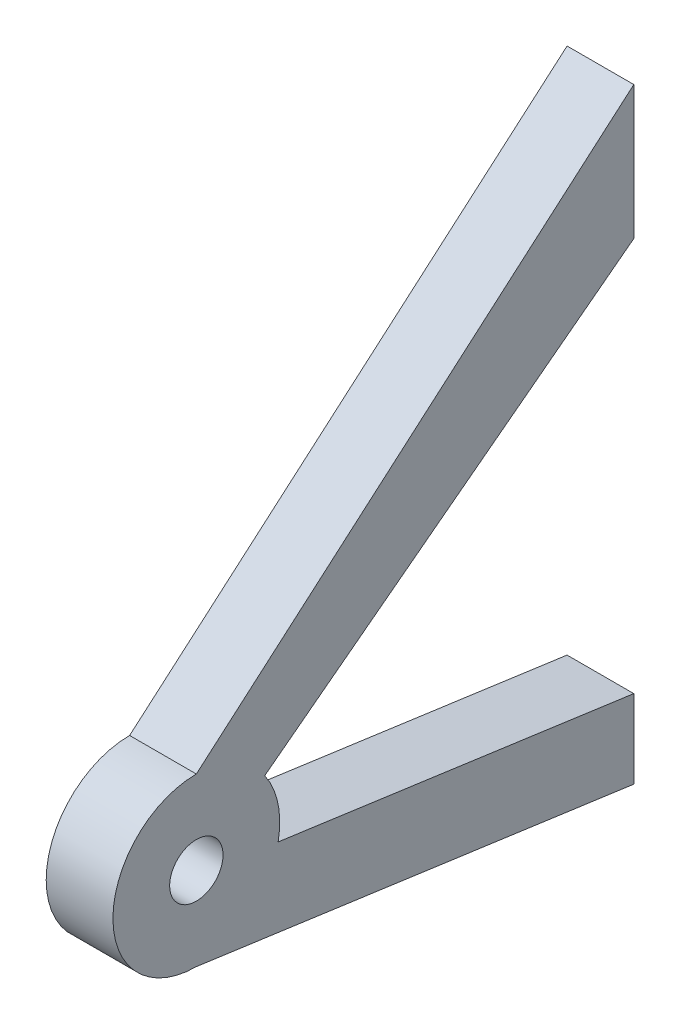
from build123d import *

# Parameters (mm, degrees)
SKETCH1_R           = 2.54
BOSS_EXTRUDE1_DEPTH = 6.35


with BuildPart() as part:
    # Sketch1 → Boss-Extrude1 (new body)
    with BuildSketch(Plane(origin=(-21.577168497, 0, 0), x_dir=(0, 0, -1), z_dir=(1, 0, 0))):
        with BuildLine():
            Line((-122.387241806, 61.361669294), (-164.013892996, 25.356612642))
            ThreePointArc((-164.013892996, 25.356612642), (-171.951392996, 17.419112642), (-164.013892996, 9.481612642))
            Line((-164.013892996, 9.481612642), (-122.387241806, 3.703044496))
            Line((-122.387241806, 3.703044496), (-122.387241806, 11.169831477))
            Line((-122.387241806, 11.169831477), (-156.229469136, 15.867774051))
            ThreePointArc((-156.229469136, 15.867774051), (-156.245156978, 19.047193392), (-157.50733564, 21.965387779))
            Line((-157.50733564, 21.965387779), (-122.387241806, 48.668462371))
            Line((-122.387241806, 48.668462371), (-122.387241806, 61.361669294))
        make_face()
        with Locations(Location((-164.013892996, 17.419112642, 0), (0, 0, 90))):
            Circle(SKETCH1_R, mode=Mode.SUBTRACT)
    extrude(amount=-BOSS_EXTRUDE1_DEPTH)


solid = part.part
